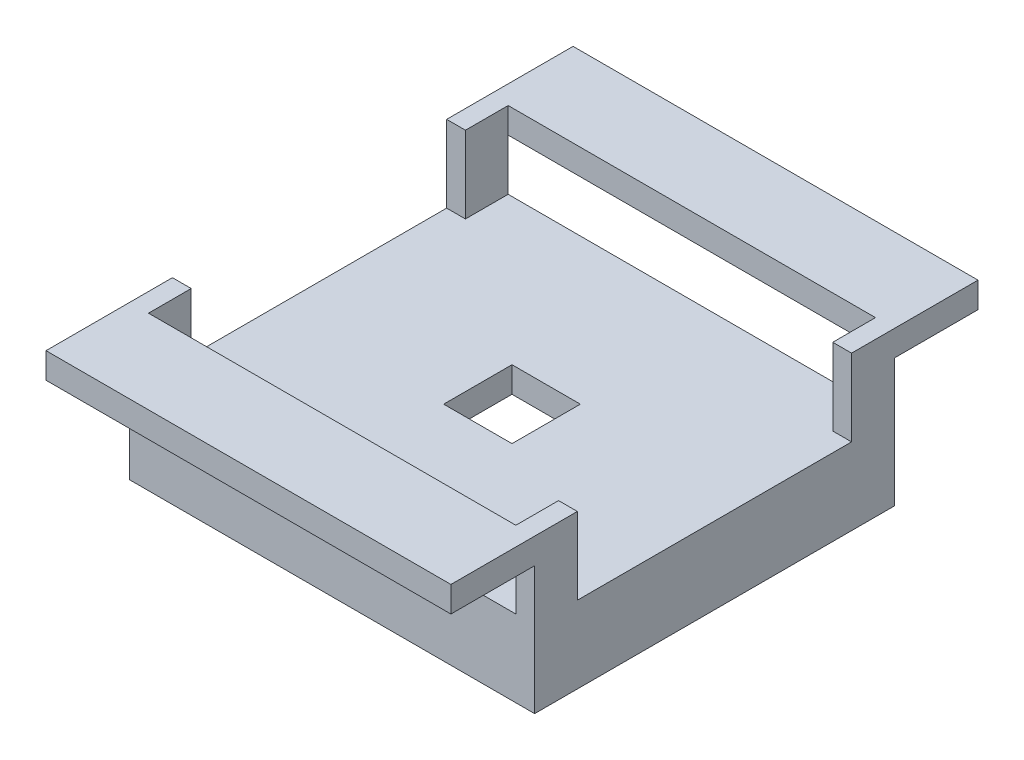
from build123d import *

# Parameters (mm, degrees)
BOSS_EXTRUDE1_DEPTH      = 2
BOSS_EXTRUDE1_DEPTH_BACK = 1
SKETCH3_W                = 47.4
SKETCH3_H                = 42.1
SKETCH4_W                = 2.2
SKETCH4_H                = 5
BOSS_EXTRUDE2_DEPTH      = 9
SKETCH6_W                = 2.2
SKETCH6_H                = 3
BOSS_EXTRUDE3_DEPTH      = 9.8
BOSS_EXTRUDE5_REACH      = 57.819
SKETCH10_W               = 9.8
SKETCH10_H               = 3
MIRROR3_COPY_1_SKETCH_W  = 2.2
MIRROR3_COPY_1_SKETCH_H  = 5
MIRROR3_COPY_1_DEPTH     = 9
MIRROR3_COPY_2_SKETCH_W  = 2.2
MIRROR3_COPY_2_SKETCH_H  = 3
MIRROR3_COPY_2_DEPTH     = 9.8
SKETCH7_W                = 8
SKETCH7_H                = 8
CUT_EXTRUDE1_DEPTH       = 3
SKETCH12_W               = 47.4
SKETCH12_H               = 42.1
BOSS_EXTRUDE6_DEPTH      = 6


with BuildPart() as part:
    # Sketch3 → Boss-Extrude1 (new, two sides: drawn at the far end of the back side and taken through both)
    with BuildSketch(Plane(origin=(0, 0, 0), x_dir=(1, 0, 0), z_dir=(0, 1, 0)).offset(-BOSS_EXTRUDE1_DEPTH_BACK)):
        Rectangle(SKETCH3_W, SKETCH3_H)
    extrude(amount=BOSS_EXTRUDE1_DEPTH + BOSS_EXTRUDE1_DEPTH_BACK)

    # Sketch4 → Boss-Extrude2 (add)
    with BuildSketch(Plane(origin=(0, 2, 0), x_dir=(1, 0, 0), z_dir=(0, 1, 0))):
        with Locations((-22.6, 18.55)):
            Rectangle(SKETCH4_W, SKETCH4_H)
    boss_extrude2 = extrude(amount=BOSS_EXTRUDE2_DEPTH)

    # Sketch6 → Boss-Extrude3 (add)
    with BuildSketch(Plane(origin=(0, 0, -21.05), x_dir=(-1, 0, 0), z_dir=(0, 0, -1))):
        with Locations((22.6, 9.5)):
            Rectangle(SKETCH6_W, SKETCH6_H)
    boss_extrude3 = extrude(amount=BOSS_EXTRUDE3_DEPTH)

    # Mirror1: Boss-Extrude2, Boss-Extrude3 across plane
    add(boss_extrude2.mirror(Plane(origin=(0, 0, 0), x_dir=(0, 0, 1), z_dir=(1, 0, 0))))
    add(boss_extrude3.mirror(Plane(origin=(0, 0, 0), x_dir=(0, 0, 1), z_dir=(1, 0, 0))))

    # Sketch10 → Boss-Extrude5 (add, up to next)
    with BuildSketch(Plane(origin=(-21.5, 0, 0), x_dir=(0, 0, -1), z_dir=(1, 0, 0)), mode=Mode.PRIVATE) as boss_extrude5_sk1:
        with Locations((25.95, 9.5)):
            Rectangle(SKETCH10_W, SKETCH10_H)
    boss_extrude5_tool1 = extrude(boss_extrude5_sk1.sketch, amount=BOSS_EXTRUDE5_REACH, mode=Mode.PRIVATE) - part.part
    boss_extrude5 = boss_extrude5_tool1.solids().sort_by_distance((-21.5, 9.5, -25.95))[0]
    add(boss_extrude5)

    # Mirror3: Boss-Extrude2, Boss-Extrude3, Boss-Extrude5 across plane
    add(boss_extrude2.mirror(Plane.XY))
    add(boss_extrude3.mirror(Plane.XY))
    add(boss_extrude5.mirror(Plane.XY))

    # Mirror3 copy 1 sketch → Mirror3 copy 1 (add)
    with BuildSketch(Plane(origin=(0, 2, 0), x_dir=(-1, 0, 0), z_dir=(0, 1, 0))):
        with Locations((-22.6, 18.55)):
            Rectangle(MIRROR3_COPY_1_SKETCH_W, MIRROR3_COPY_1_SKETCH_H)
    extrude(amount=MIRROR3_COPY_1_DEPTH)

    # Mirror3 copy 2 sketch → Mirror3 copy 2 (add)
    with BuildSketch(Plane.XY.offset(21.05)):
        with Locations((22.6, 9.5)):
            Rectangle(MIRROR3_COPY_2_SKETCH_W, MIRROR3_COPY_2_SKETCH_H)
    extrude(amount=MIRROR3_COPY_2_DEPTH)

    # Sketch7 → Cut-Extrude1 (cut)
    with BuildSketch(Plane.XZ.offset(1)):
        Rectangle(SKETCH7_W, SKETCH7_H)
    extrude(amount=-CUT_EXTRUDE1_DEPTH, mode=Mode.SUBTRACT)

    # Sketch12 → Boss-Extrude6 (add)
    with BuildSketch(Plane.XZ.offset(1)):
        Rectangle(SKETCH12_W, SKETCH12_H)
    extrude(amount=BOSS_EXTRUDE6_DEPTH)

    # loft from a face of the part (cut_loft1)
    loft([part.faces().sort_by_distance((0, -7, 0))[0], part.faces().sort_by_distance((0, -1, 0))[0]], mode=Mode.SUBTRACT)


solid = part.part
